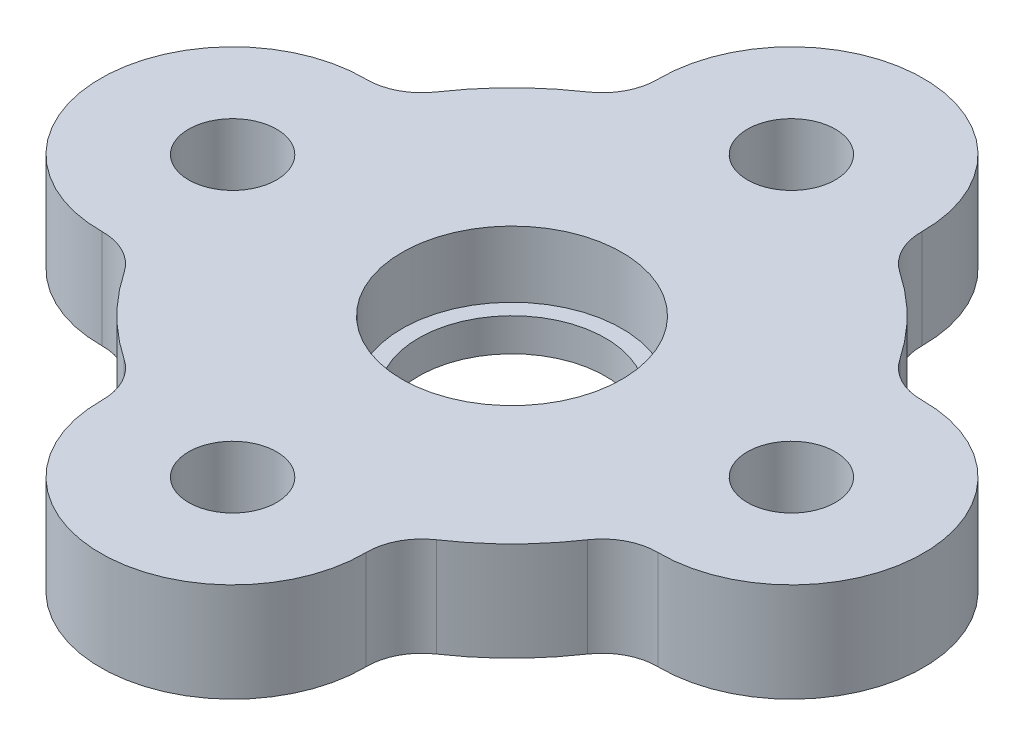
from build123d import *

# Parameters (mm, degrees)
SKETCH1_R                  = 4
SKETCH1_R_2                = 8.5
BODY_AND_CENTER_HOLE_DEPTH = 9
SKETCH2_R                  = 10
SEAL_CAVITY_DEPTH          = 6


with BuildPart() as part:
    # Sketch1 → body and center hole (new body)
    with BuildSketch(Plane(origin=(0, 0, 0), x_dir=(1, 0, 0), z_dir=(0, 1, 0))):
        with BuildLine():
            ThreePointArc((11.999195473, 25.261046781), (0, 37.4), (-11.999195473, 25.261046781))
            ThreePointArc((-11.999195473, 25.261046781), (-12.570633341, 22.881338587), (-14.20299508, 21.057894737))
            ThreePointArc((-14.20299508, 21.057894737), (-17.960512242, 17.960512242), (-21.057894737, 14.20299508))
            ThreePointArc((-21.057894737, 14.20299508), (-22.881338587, 12.570633341), (-25.261046781, 11.999195473))
            ThreePointArc((-25.261046781, 11.999195473), (-37.4, 0), (-25.261046781, -11.999195473))
            ThreePointArc((-25.261046781, -11.999195473), (-22.881338587, -12.570633341), (-21.057894737, -14.20299508))
            ThreePointArc((-21.057894737, -14.20299508), (-17.960512242, -17.960512242), (-14.20299508, -21.057894737))
            ThreePointArc((-14.20299508, -21.057894737), (-12.570633341, -22.881338587), (-11.999195473, -25.261046781))
            ThreePointArc((-11.999195473, -25.261046781), (0, -37.4), (11.999195473, -25.261046781))
            ThreePointArc((11.999195473, -25.261046781), (12.570633341, -22.881338587), (14.20299508, -21.057894737))
            ThreePointArc((14.20299508, -21.057894737), (17.960512242, -17.960512242), (21.057894737, -14.20299508))
            ThreePointArc((21.057894737, -14.20299508), (22.881338587, -12.570633341), (25.261046781, -11.999195473))
            ThreePointArc((25.261046781, -11.999195473), (37.4, 0), (25.261046781, 11.999195473))
            ThreePointArc((25.261046781, 11.999195473), (22.881338587, 12.570633341), (21.057894737, 14.20299508))
            ThreePointArc((21.057894737, 14.20299508), (17.960512242, 17.960512242), (14.20299508, 21.057894737))
            ThreePointArc((14.20299508, 21.057894737), (12.570633341, 22.881338587), (11.999195473, 25.261046781))
        make_face()
        with Locations(Location((-25.4, 0, 0), (0, 0, 270))):
            Circle(SKETCH1_R, mode=Mode.SUBTRACT)
        with Locations(Location((0, 25.4, 0), (0, 0, 270))):
            Circle(SKETCH1_R, mode=Mode.SUBTRACT)
        with Locations(Location((25.4, 0, 0), (0, 0, 270))):
            Circle(SKETCH1_R, mode=Mode.SUBTRACT)
        with Locations(Location((0, -25.4, 0), (0, 0, 270))):
            Circle(SKETCH1_R, mode=Mode.SUBTRACT)
        with Locations(Location((0, 0, 0), (0, 0, 270))):
            Circle(SKETCH1_R_2, mode=Mode.SUBTRACT)
    extrude(amount=BODY_AND_CENTER_HOLE_DEPTH)

    # Sketch2 → seal cavity (cut)
    with BuildSketch(Plane(origin=(0, 9, 0), x_dir=(1, 0, 0), z_dir=(0, 1, 0))):
        with Locations(Location((0, 0, 0), (0, 0, 270))):
            Circle(SKETCH2_R)
    extrude(amount=-SEAL_CAVITY_DEPTH, mode=Mode.SUBTRACT)


solid = part.part
